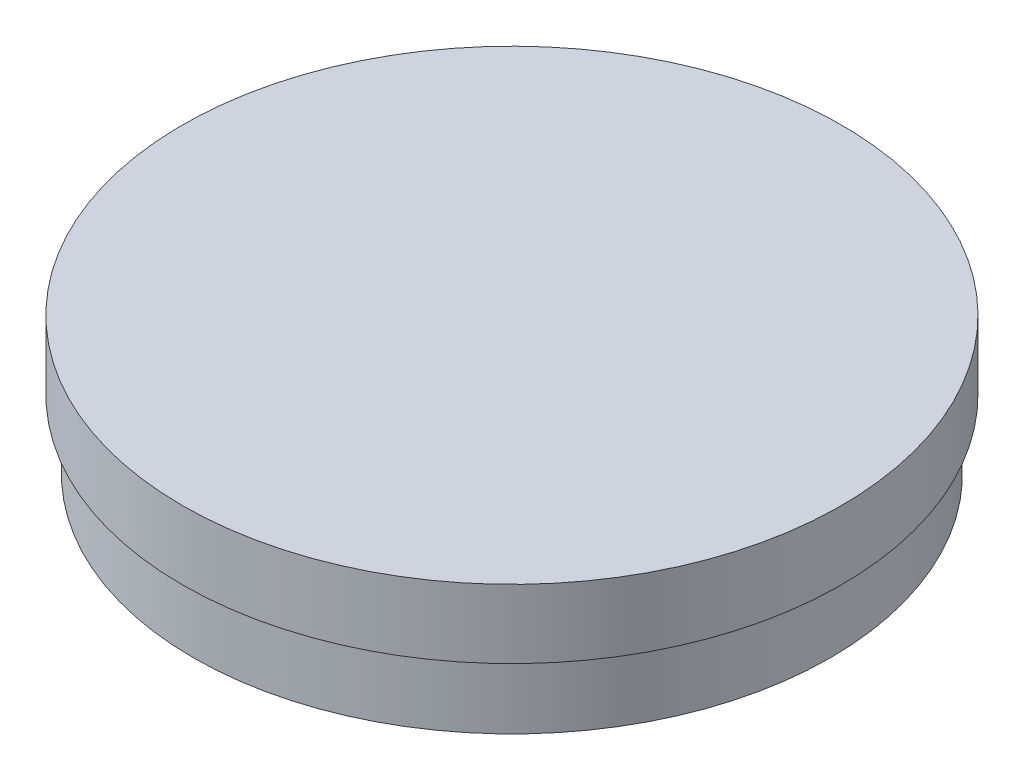
from build123d import *


with BuildPart() as part:
    # Sketch1 → Revolve1 (revolve)
    with BuildSketch(Plane.XY, mode=Mode.PRIVATE) as revolve1_sk:
        Polygon((0, 48.053571429), (120, 48.053571429), (120, 23.053571429), (116, 23.053571429), (116, -1.946428571), (0, -1.946428571), align=None)
    revolve(revolve1_sk.sketch.rotate(Axis((0, 53.160714286, 0), (0, -1, 0)), 90), axis=Axis((0, 53.160714286, 0), (0, -1, 0)))


solid = part.part
